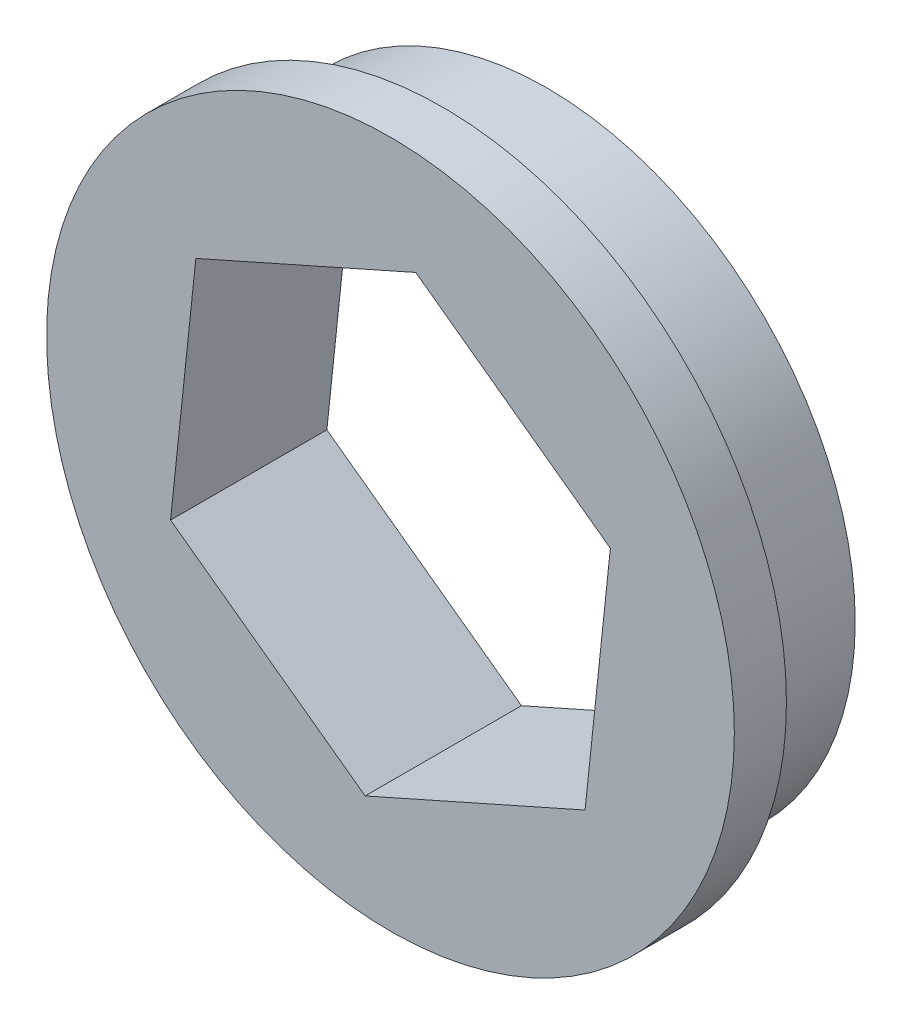
from build123d import *

# Parameters (mm, degrees)
SKETCH1_R           = 9.398
BOSS_EXTRUDE1_DEPTH = 3.175
SKETCH2_R           = 10.4775
BOSS_EXTRUDE2_DEPTH = 1.5875


with BuildPart() as part:
    # Sketch1 → Boss-Extrude1 (new body)
    with BuildSketch(Plane.XY):
        Circle(SKETCH1_R)
        Polygon((0.770929448, 7.291707696), (-5.929339377, 4.313498334), (-6.700268825, -2.978209361), (-0.770929448, -7.291707696), (5.929339377, -4.313498334), (6.700268825, 2.978209361), align=None, mode=Mode.SUBTRACT)
    extrude(amount=BOSS_EXTRUDE1_DEPTH)

    # Sketch2 → Boss-Extrude2 (add)
    with BuildSketch(Plane.XY.offset(3.175)):
        Circle(SKETCH2_R)
        Polygon((0.770929448, 7.291707696), (-5.929339377, 4.313498334), (-6.700268825, -2.978209361), (-0.770929448, -7.291707696), (5.929339377, -4.313498334), (6.700268825, 2.978209361), align=None, mode=Mode.SUBTRACT)
    extrude(amount=BOSS_EXTRUDE2_DEPTH)


solid = part.part
